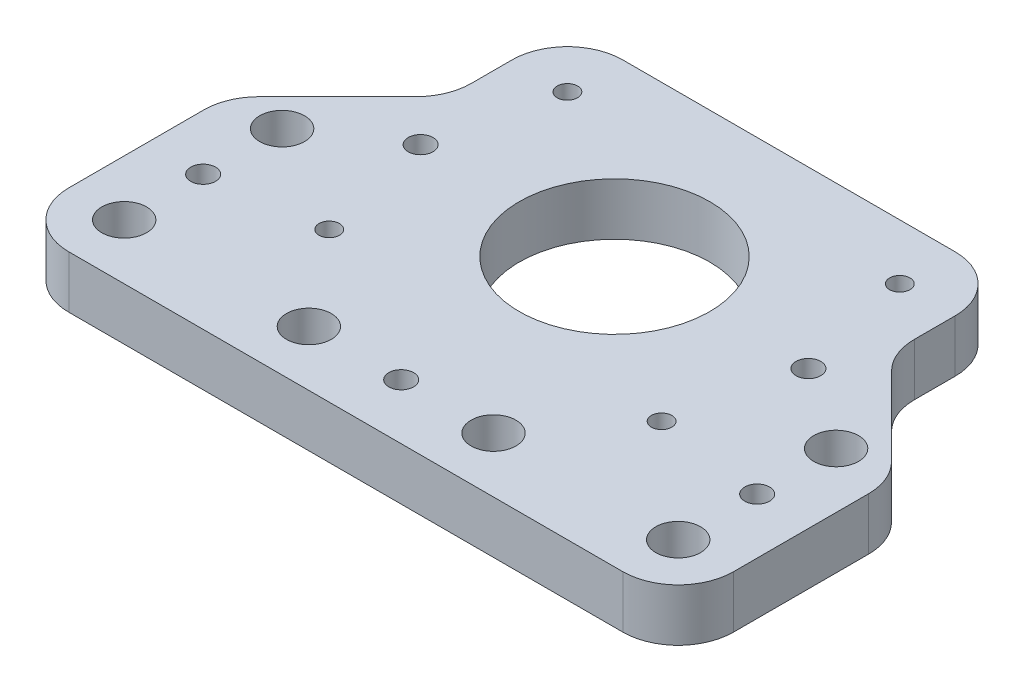
from build123d import *

# Parameters (mm, degrees)
SKETCH1_R           = 11
BOSS_EXTRUDE1_DEPTH = 6
SKETCH2_R           = 1.5
CUT_EXTRUDE1_DEPTH  = 92.777339251
SKETCH14_R          = 1.25
M3_TAP_DEPTH        = 92.777339251
SKETCH15_R          = 2.65
M5_THROUGH_DEPTH    = 92.777339251
CUT_EXTRUDE2_DEPTH  = 92.777339251
FILLET2_R           = 6.35
SKETCH13_R          = 1.5
CUT_EXTRUDE3_DEPTH  = 92.777339251
MOVE_FACE1_BY       = 0.08
MOVE_FACE1_2_BY     = 0.08
MOVE_FACE1_3_BY     = 0.08
MOVE_FACE1_4_BY     = 0.08
MOVE_FACE1_5_BY     = 0.08
MOVE_FACE1_6_BY     = 0.08
MOVE_FACE1_7_BY     = 0.08
MOVE_FACE1_8_BY     = 0.08
MOVE_FACE1_9_BY     = 0.08
MOVE_FACE1_10_BY    = 0.08
MOVE_FACE1_11_BY    = 0.08
MOVE_FACE1_12_BY    = 0.08
MOVE_FACE1_13_BY    = 0.08
MOVE_FACE1_14_BY    = 0.08
MOVE_FACE1_15_BY    = 0.08
MOVE_FACE1_16_BY    = 0.08


with BuildPart() as part:
    # Sketch1 → Boss-Extrude1 (new body)
    with BuildSketch(Plane(origin=(0, 0, 0), x_dir=(1, 0, 0), z_dir=(0, 1, 0))):
        Polygon((0, 0), (76.2, 0), (76.2, 50.8), (38.1, 50.8), (0, 50.8), align=None)
        with Locations(Location((38.1, 30.8, 0), (0, 0, 270))):
            Circle(SKETCH1_R, mode=Mode.SUBTRACT)
    extrude(amount=BOSS_EXTRUDE1_DEPTH)

    # Sketch2 → Cut-Extrude1 (cut, through all)
    with BuildSketch(Plane(origin=(0, 6, 0), x_dir=(1, 0, 0), z_dir=(0, 1, 0))):
        with Locations(Location((15.875, 30.8, 0), (0, 0, 270))):
            Circle(SKETCH2_R)
        with Locations(Location((60.325, 30.8, 0), (0, 0, 90))):
            Circle(SKETCH2_R)
    extrude(amount=-CUT_EXTRUDE1_DEPTH, mode=Mode.SUBTRACT)

    # Sketch14 → M3-tap (cut, through all)
    with BuildSketch(Plane.XZ):
        with Locations(Location((57.15, -44.45, 0), (0, 0, 270))):
            Circle(SKETCH14_R)
        with Locations(Location((19.05, -44.45, 0), (0, 0, 270))):
            Circle(SKETCH14_R)
        with Locations(Location((19.05, -17.15, 0), (0, 0, 270))):
            Circle(SKETCH14_R)
        with Locations(Location((57.15, -17.15, 0), (0, 0, 270))):
            Circle(SKETCH14_R)
    extrude(amount=-M3_TAP_DEPTH, mode=Mode.SUBTRACT)

    # Sketch15 → M5-through (cut, through all)
    with BuildSketch(Plane.XZ):
        with Locations(Location((69.85, -24.45004, 0), (0, 0, 270))):
            Circle(SKETCH15_R)
        with Locations(Location((69.85, -6.35, 0), (0, 0, 270))):
            Circle(SKETCH15_R)
        with Locations(Location((48.683333333, -6.35, 0), (0, 0, 270))):
            Circle(SKETCH15_R)
        with Locations(Location((27.516666667, -6.35, 0), (0, 0, 270))):
            Circle(SKETCH15_R)
        with Locations(Location((6.35, -6.35, 0), (0, 0, 270))):
            Circle(SKETCH15_R)
        with Locations(Location((6.35, -24.45004, 0), (0, 0, 270))):
            Circle(SKETCH15_R)
    extrude(amount=-M5_THROUGH_DEPTH, mode=Mode.SUBTRACT)

    # Sketch12 → Cut-Extrude2 (cut, through all)
    with BuildSketch(Plane(origin=(0, 6, 0), x_dir=(1, 0, 0), z_dir=(0, 1, 0))):
        Polygon((0, 50.8), (12.7, 50.8), (12.7, 37.15), (0, 24.45), align=None)
        Polygon((63.5, 50.8), (63.5, 37.15), (76.2, 24.45), (76.2, 50.8), align=None)
    extrude(amount=-CUT_EXTRUDE2_DEPTH, mode=Mode.SUBTRACT)

    # Fillet2
    fillet2_edges = [part.edges().sort_by_distance(p)[0] for p in [
        (0, 3, -24.45),
        (12.7, 3, -50.8),
        (12.7, 3, -37.15),
        (76.2, 3, 0),
        (63.5, 3, -50.8),
        (0, 3, 0),
        (76.2, 3, -24.45),
        (63.5, 3, -37.15),
    ]]
    fillet(fillet2_edges, radius=FILLET2_R)

    # Sketch13 → Cut-Extrude3 (cut, through all)
    with BuildSketch(Plane.XZ):
        with Locations(Location((69.85, -15.40002, 0), (0, 0, 270))):
            Circle(SKETCH13_R)
        with Locations(Location((38.1, -6.35, 0), (0, 0, 270))):
            Circle(SKETCH13_R)
        with Locations(Location((6.35, -15.40002, 0), (0, 0, 270))):
            Circle(SKETCH13_R)
    extrude(amount=-CUT_EXTRUDE3_DEPTH, mode=Mode.SUBTRACT)

    # Move Face1: a curved face moved outward by 0.08
    add(Solid.thicken(part.faces().sort_by_distance((38.1, 3, -41.8))[0], MOVE_FACE1_BY))

    # Move Face1 2: a curved face moved outward by 0.08
    add(Solid.thicken(part.faces().sort_by_distance((15.875, 3, -32.3))[0], MOVE_FACE1_2_BY))

    # Move Face1 3: a curved face moved outward by 0.08
    add(Solid.thicken(part.faces().sort_by_distance((60.325, 3, -29.3))[0], MOVE_FACE1_3_BY))

    # Move Face1 4: a curved face moved outward by 0.08
    add(Solid.thicken(part.faces().sort_by_distance((57.15, 3, -43.2))[0], MOVE_FACE1_4_BY))

    # Move Face1 5: a curved face moved outward by 0.08
    add(Solid.thicken(part.faces().sort_by_distance((19.05, 3, -43.2))[0], MOVE_FACE1_5_BY))

    # Move Face1 6: a curved face moved outward by 0.08
    add(Solid.thicken(part.faces().sort_by_distance((19.05, 3, -15.9))[0], MOVE_FACE1_6_BY))

    # Move Face1 7: a curved face moved outward by 0.08
    add(Solid.thicken(part.faces().sort_by_distance((57.15, 3, -15.9))[0], MOVE_FACE1_7_BY))

    # Move Face1 8: a curved face moved outward by 0.08
    add(Solid.thicken(part.faces().sort_by_distance((69.85, 3, -21.80004))[0], MOVE_FACE1_8_BY))

    # Move Face1 9: a curved face moved outward by 0.08
    add(Solid.thicken(part.faces().sort_by_distance((69.85, 3, -3.7))[0], MOVE_FACE1_9_BY))

    # Move Face1 10: a curved face moved outward by 0.08
    add(Solid.thicken(part.faces().sort_by_distance((48.683333333, 3, -3.7))[0], MOVE_FACE1_10_BY))

    # Move Face1 11: a curved face moved outward by 0.08
    add(Solid.thicken(part.faces().sort_by_distance((27.516666667, 3, -3.7))[0], MOVE_FACE1_11_BY))

    # Move Face1 12: a curved face moved outward by 0.08
    add(Solid.thicken(part.faces().sort_by_distance((6.35, 3, -3.7))[0], MOVE_FACE1_12_BY))

    # Move Face1 13: a curved face moved outward by 0.08
    add(Solid.thicken(part.faces().sort_by_distance((6.35, 3, -21.80004))[0], MOVE_FACE1_13_BY))

    # Move Face1 14: a curved face moved outward by 0.08
    add(Solid.thicken(part.faces().sort_by_distance((69.85, 3, -13.90002))[0], MOVE_FACE1_14_BY))

    # Move Face1 15: a curved face moved outward by 0.08
    add(Solid.thicken(part.faces().sort_by_distance((38.1, 3, -4.85))[0], MOVE_FACE1_15_BY))

    # Move Face1 16: a curved face moved outward by 0.08
    add(Solid.thicken(part.faces().sort_by_distance((6.35, 3, -13.90002))[0], MOVE_FACE1_16_BY))


solid = part.part
